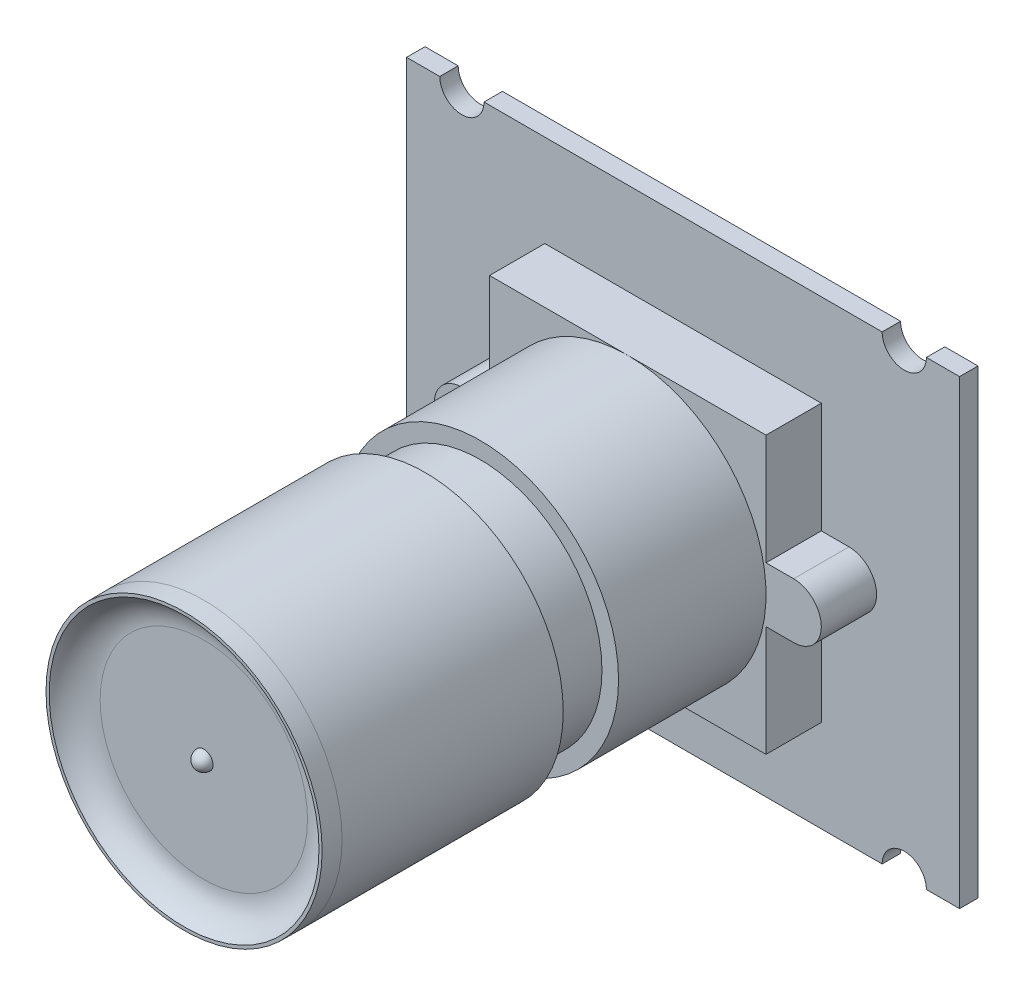
from build123d import *

# Parameters (mm, degrees)
EXTRUDE_1_DEPTH = 1
EXTRUDE_2_DEPTH = 3
SKETCH_3_W      = 15
SKETCH_3_H      = 15
EXTRUDE_3_DEPTH = 3
SKETCH_4_R      = 7.5
EXTRUDE_4_DEPTH = 8
SKETCH_5_R      = 6.6
EXTRUDE_5_DEPTH = 3


with BuildPart() as part:
    # 草图1 → 凸台-拉伸1 (new body)
    with BuildSketch(Plane.XY):
        with BuildLine():
            Line((4.2, 8.956043956), (25.8, 8.956043956))
            ThreePointArc((25.8, 8.956043956), (27, 7.756043956), (28.2, 8.956043956))
            Line((28.2, 8.956043956), (30, 8.956043956))
            Line((30, 8.956043956), (30, -16.043956044))
            Line((30, -16.043956044), (28.2, -16.043956044))
            ThreePointArc((28.2, -16.043956044), (27, -14.843956044), (25.8, -16.043956044))
            Line((25.8, -16.043956044), (4.2, -16.043956044))
            ThreePointArc((4.2, -16.043956044), (3, -14.843956044), (1.8, -16.043956044))
            Line((1.8, -16.043956044), (0, -16.043956044))
            Line((0, -16.043956044), (0, 8.956043956))
            Line((0, 8.956043956), (1.8, 8.956043956))
            ThreePointArc((1.8, 8.956043956), (3, 7.756043956), (4.2, 8.956043956))
        make_face()
    extrude(amount=EXTRUDE_1_DEPTH)

    # 草图2 → 凸台-拉伸2 (add)
    with BuildSketch(Plane.XY.offset(1)):
        with BuildLine():
            Line((6, -2.043956044), (24, -2.043956044))
            ThreePointArc((24, -2.043956044), (25.5, -3.543956044), (24, -5.043956044))
            Line((24, -5.043956044), (6, -5.043956044))
            ThreePointArc((6, -5.043956044), (4.5, -3.543956044), (6, -2.043956044))
        make_face()
    extrude(amount=EXTRUDE_2_DEPTH)

    # 草图3 → 凸台-拉伸3 (add)
    with BuildSketch(Plane.XY.offset(1)):
        with Locations((15, -3.543956044)):
            Rectangle(SKETCH_3_W, SKETCH_3_H)
    extrude(amount=EXTRUDE_3_DEPTH)

    # 草图4 → 凸台-拉伸4 (add)
    with BuildSketch(Plane.XY.offset(4)):
        with Locations(Location((15, -3.543956044, 0), (0, 0, 270))):
            Circle(SKETCH_4_R)
    extrude(amount=EXTRUDE_4_DEPTH)

    # 草图5 → 凸台-拉伸5 (add)
    with BuildSketch(Plane.XY.offset(12)):
        with Locations((15, -3.543956044)):
            Circle(SKETCH_5_R)
    extrude(amount=EXTRUDE_5_DEPTH)

    # 草图7 → 旋转2 (revolve)
    with BuildSketch(Plane(origin=(0, -3.543956044, 0), x_dir=(-1, 0, 0), z_dir=(0, -1, 0)), mode=Mode.PRIVATE) as revolve_2_sk:
        with BuildLine():
            Line((-15, -15), (-7.5, -15))
            Line((-7.5, -15), (-7.5, -27))
            Line((-7.5, -27), (-7.5095257, -28.070803971))
            Line((-7.5095257, -28.070803971), (-7.681219097, -28.070803971))
            ThreePointArc((-7.681219097, -28.070803971), (-8.373062515, -27.290151024), (-9.375, -27))
            Line((-9.375, -27), (-14.500000001, -27))
            ThreePointArc((-14.500000001, -27), (-14.646437925, -27.353569269), (-15, -27.500024563))
            Line((-15, -27.500024563), (-15, -27.000024563))
            Line((-15, -27.000024563), (-15, -22))
            Line((-15, -22), (-15, -15))
        make_face()
    revolve(revolve_2_sk.sketch.rotate(Axis((15, -3.543956044, 22), (0, 0, -1)), 180), axis=Axis((15, -3.543956044, 22), (0, 0, -1)))


solid = part.part
